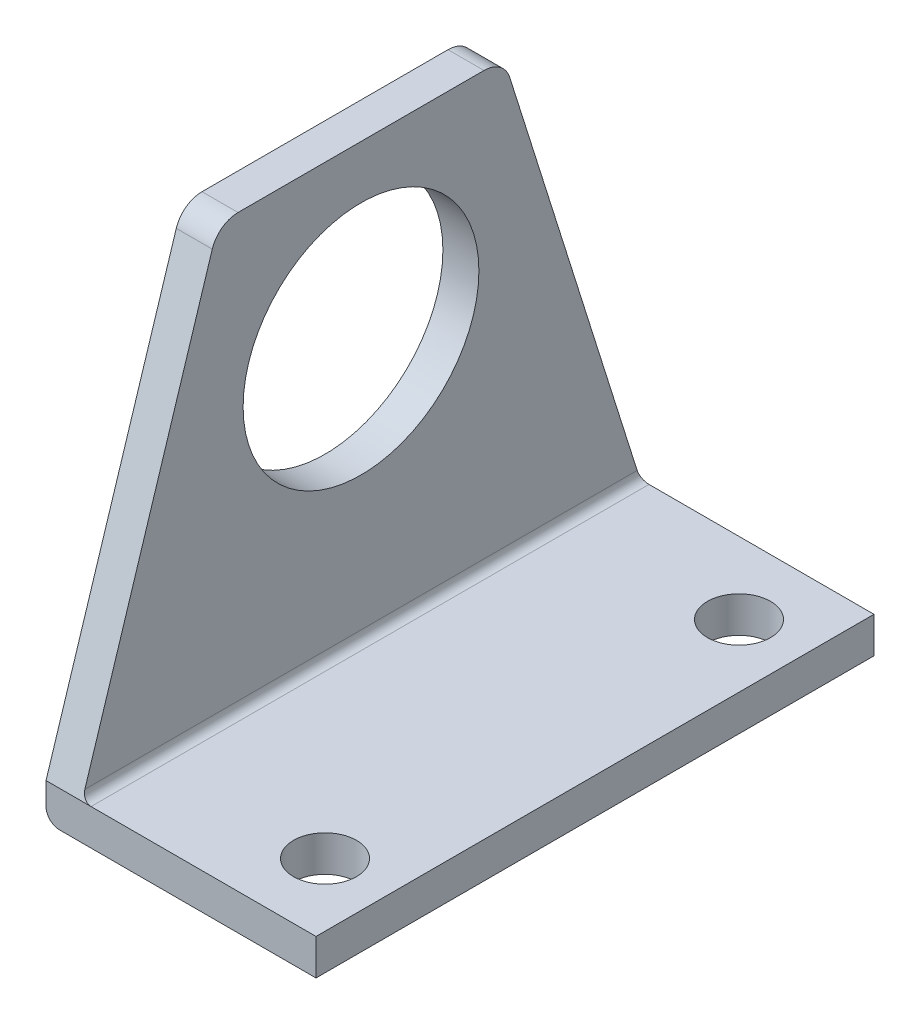
from build123d import *

# Parameters (mm, degrees)
SKETCH_1_R               = 13.1
EXTRUDE_1_DEPTH          = 30
CUT_EXTRUDE_1_DEPTH      = 31
CUT_EXTRUDE_1_DEPTH_BACK = 31
CUT_EXTRUDE_2_DEPTH      = 31
CUT_EXTRUDE_2_DEPTH_BACK = 31
CUT_EXTRUDE_3_DEPTH      = 4
CUT_EXTRUDE_3_DEPTH_BACK = 4
SKETCH_4_R               = 3.5
CUT_EXTRUDE_4_DEPTH      = 4
CUT_EXTRUDE_4_DEPTH_BACK = 4
SKETCH_5_R               = 3.5


with BuildPart() as part:
    # 草图1 → 凸台-拉伸1 (new body)
    with BuildSketch(Plane(origin=(0, 0, 0), x_dir=(0, 0, -1), z_dir=(1, 0, 0))):
        with BuildLine():
            Line((-31, 0), (31, 0))
            Line((31, 0), (31, 4))
            Line((31, 4), (16.527117977, 49.902117399))
            ThreePointArc((16.527117977, 49.902117399), (15.43989607, 51.419333813), (13.665967125, 52))
            Line((13.665967125, 52), (-13.665967125, 52))
            ThreePointArc((-13.665967125, 52), (-15.43989607, 51.419333813), (-16.527117977, 49.902117399))
            Line((-16.527117977, 49.902117399), (-31, 4))
            Line((-31, 4), (-31, 0))
        make_face()
        with Locations((0, 33)):
            Circle(SKETCH_1_R, mode=Mode.SUBTRACT)
    extrude(amount=EXTRUDE_1_DEPTH)

    # 草图2 → 切除-拉伸1 (cut, two sides: drawn at the far end of the back side and taken through both)
    with BuildSketch(Plane.XY.offset(-CUT_EXTRUDE_1_DEPTH_BACK)):
        with BuildLine():
            Line((5, 4), (30, 4))
            Line((30, 4), (30, 52))
            Line((30, 52), (4, 52))
            Line((4, 52), (4, 5))
            ThreePointArc((4, 5), (4.292893219, 4.292893219), (5, 4))
        make_face()
    extrude(amount=CUT_EXTRUDE_1_DEPTH + CUT_EXTRUDE_1_DEPTH_BACK, mode=Mode.SUBTRACT)

    # 草图3 → 切除-拉伸2 (cut, two sides: drawn at the far end of the back side and taken through both)
    with BuildSketch(Plane.XY.offset(-CUT_EXTRUDE_2_DEPTH_BACK)):
        with BuildLine():
            Line((-1, -1), (1.5, -1))
            Line((1.5, -1), (1.5, 0))
            ThreePointArc((1.5, 0), (0.439339828, 0.439339828), (0, 1.5))
            Line((0, 1.5), (-1, 1.5))
            Line((-1, 1.5), (-1, -1))
        make_face()
    extrude(amount=CUT_EXTRUDE_2_DEPTH + CUT_EXTRUDE_2_DEPTH_BACK, mode=Mode.SUBTRACT)

    # 草图4 → 切除-拉伸3 (cut, two sides: drawn at the far end of the back side and taken through both)
    with BuildSketch(Plane(origin=(0, 0, 0), x_dir=(1, 0, 0), z_dir=(0, 1, 0)).offset(-CUT_EXTRUDE_3_DEPTH_BACK)):
        with Locations((23, 23)):
            Circle(SKETCH_4_R)
    extrude(amount=CUT_EXTRUDE_3_DEPTH + CUT_EXTRUDE_3_DEPTH_BACK, mode=Mode.SUBTRACT)

    # 草图5 → 切除-拉伸4 (cut, two sides: drawn at the far end of the back side and taken through both)
    with BuildSketch(Plane(origin=(0, 0, 0), x_dir=(1, 0, 0), z_dir=(0, 1, 0)).offset(-CUT_EXTRUDE_4_DEPTH_BACK)):
        with Locations((23, -23)):
            Circle(SKETCH_5_R)
    extrude(amount=CUT_EXTRUDE_4_DEPTH + CUT_EXTRUDE_4_DEPTH_BACK, mode=Mode.SUBTRACT)


solid = part.part
